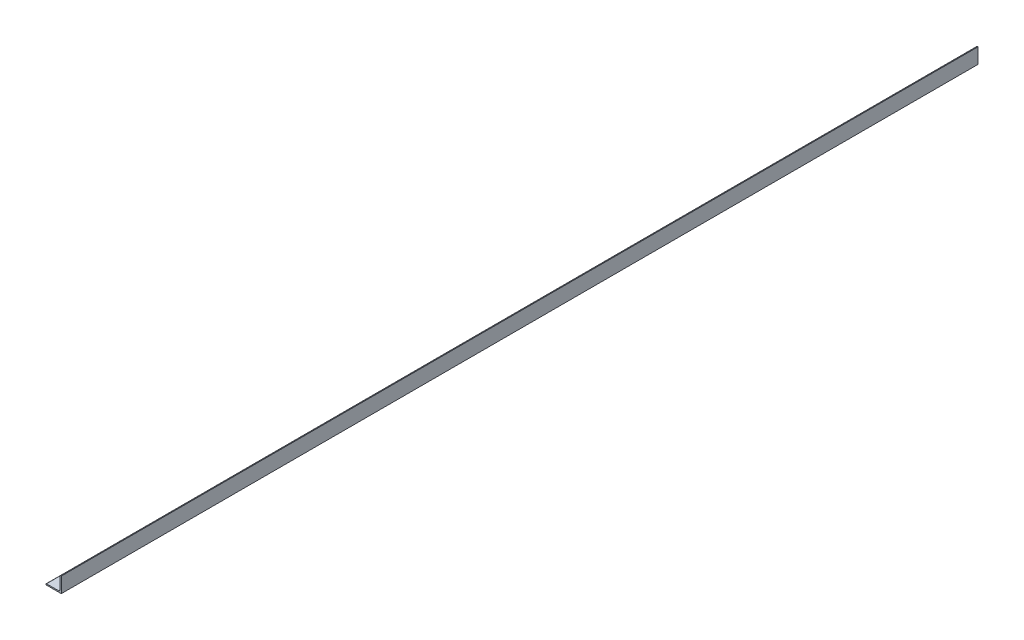
from build123d import *

# Parameters (mm, degrees)
EXTRUDE_1_DEPTH = 1500


with BuildPart() as part:
    # Эскиз1 → Бобышка-Вытянуть1 (new, symmetric)
    with BuildSketch(Plane(origin=(0, 0, 0), x_dir=(-1, 0, 0), z_dir=(0, 0, -1))):
        with BuildLine():
            Line((0, 0), (0, 50))
            Line((0, 50), (2.2, 50))
            ThreePointArc((2.2, 50), (3.472792206, 49.472792206), (4, 48.2))
            Line((4, 48.2), (4, 9.5))
            ThreePointArc((4, 9.5), (5.610912703, 5.610912703), (9.5, 4))
            Line((9.5, 4), (48.2, 4))
            ThreePointArc((48.2, 4), (49.472792206, 3.472792206), (50, 2.2))
            Line((50, 2.2), (50, 0))
            Line((50, 0), (0, 0))
        make_face()
    extrude(amount=EXTRUDE_1_DEPTH, both=True)


solid = part.part
